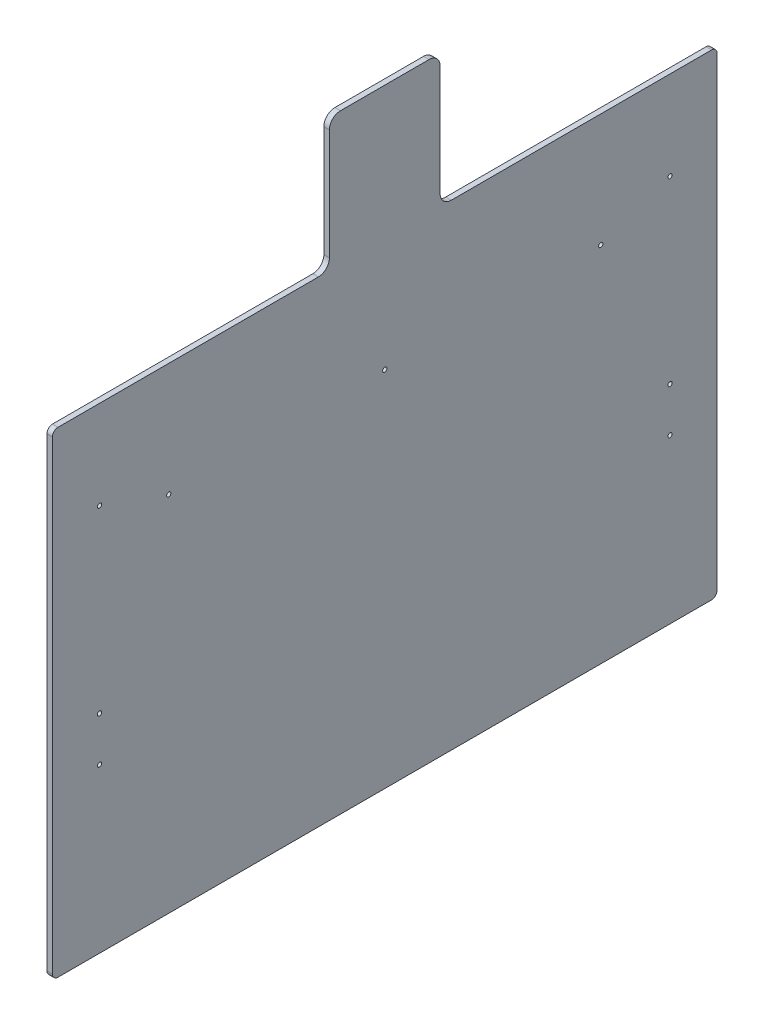
from build123d import *

# Parameters (mm, degrees)
SKETCH1_R           = 2.45745
BOSS_EXTRUDE1_DEPTH = 6.35
SKETCH3_R           = 2.45745
CUT_EXTRUDE2_DEPTH  = 1034.724611538


with BuildPart() as part:
    # Sketch1 → Boss-Extrude1 (new body)
    with BuildSketch(Plane(origin=(0, 0, 0), x_dir=(0, 0, -1), z_dir=(1, 0, 0))):
        with BuildLine():
            Line((457.2, 546.1), (755.65, 546.1))
            ThreePointArc((755.65, 546.1), (760.140128061, 544.240128061), (762, 539.75))
            Line((762, 539.75), (762, 6.35))
            ThreePointArc((762, 6.35), (760.140128061, 1.859871939), (755.65, 0))
            Line((755.65, 0), (6.35, 0))
            ThreePointArc((6.35, 0), (1.859871939, 1.859871939), (0, 6.35))
            Line((0, 6.35), (0, 539.75))
            ThreePointArc((0, 539.75), (1.859871939, 544.240128061), (6.35, 546.1))
            Line((6.35, 546.1), (304.8, 546.1))
            ThreePointArc((304.8, 546.1), (313.780256121, 549.819743879), (317.5, 558.8))
            Line((317.5, 558.8), (317.5, 685.8))
            ThreePointArc((317.5, 685.8), (321.219743879, 694.780256121), (330.2, 698.5))
            Line((330.2, 698.5), (431.8, 698.5))
            ThreePointArc((431.8, 698.5), (440.780256121, 694.780256121), (444.5, 685.8))
            Line((444.5, 685.8), (444.5, 558.8))
            ThreePointArc((444.5, 558.8), (448.219743879, 549.819743879), (457.2, 546.1))
        make_face()
        with Locations((53.975, 444.5)):
            Circle(SKETCH1_R, mode=Mode.SUBTRACT)
        with Locations((708.025, 444.5)):
            Circle(SKETCH1_R, mode=Mode.SUBTRACT)
        with Locations((708.025, 238.125)):
            Circle(SKETCH1_R, mode=Mode.SUBTRACT)
        with Locations((53.975, 238.125)):
            Circle(SKETCH1_R, mode=Mode.SUBTRACT)
        with Locations((53.975, 187.325)):
            Circle(SKETCH1_R, mode=Mode.SUBTRACT)
        with Locations((708.025, 187.325)):
            Circle(SKETCH1_R, mode=Mode.SUBTRACT)
    extrude(amount=BOSS_EXTRUDE1_DEPTH)

    # Sketch3 → Cut-Extrude2 (cut, through all)
    with BuildSketch(Plane(origin=(6.35, 0, 0), x_dir=(0, 0, -1), z_dir=(1, 0, 0))):
        with Locations((133.35, 415.925)):
            Circle(SKETCH3_R)
        with Locations((381, 415.925)):
            Circle(SKETCH3_R)
        with Locations((628.65, 415.925)):
            Circle(SKETCH3_R)
    extrude(amount=-CUT_EXTRUDE2_DEPTH, mode=Mode.SUBTRACT)


solid = part.part
